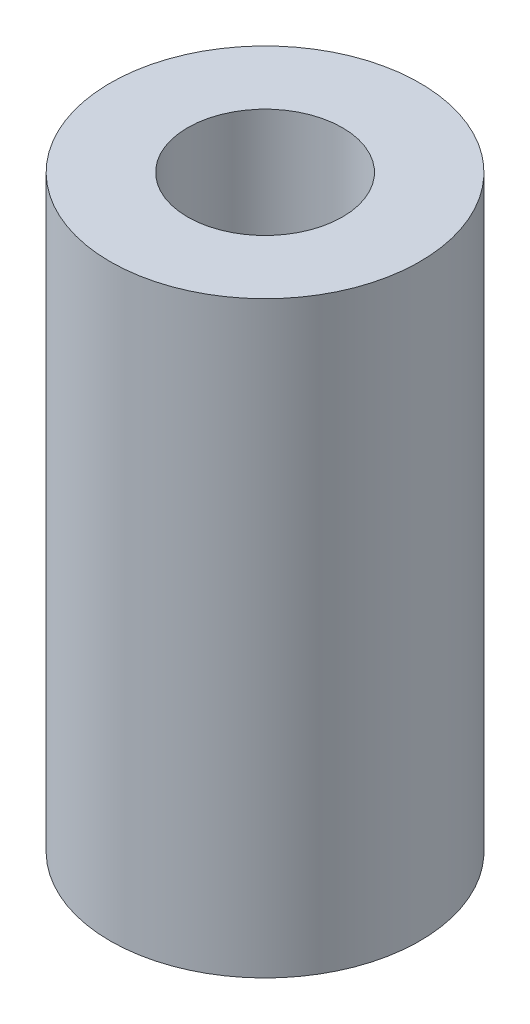
from build123d import *

# Parameters (mm, degrees)
SKETCH1_R           = 5
SKETCH1_R_2         = 2.5
BOSS_EXTRUDE1_DEPTH = 19


with BuildPart() as part:
    # Sketch1 → Boss-Extrude1 (new body)
    with BuildSketch(Plane(origin=(0, 0, 0), x_dir=(1, 0, 0), z_dir=(0, 1, 0))):
        with Locations(Location((0, 0, 0), (0, 0, 270))):
            Circle(SKETCH1_R)
        with Locations(Location((0, 0, 0), (0, 0, 270))):
            Circle(SKETCH1_R_2, mode=Mode.SUBTRACT)
    extrude(amount=BOSS_EXTRUDE1_DEPTH)


solid = part.part
